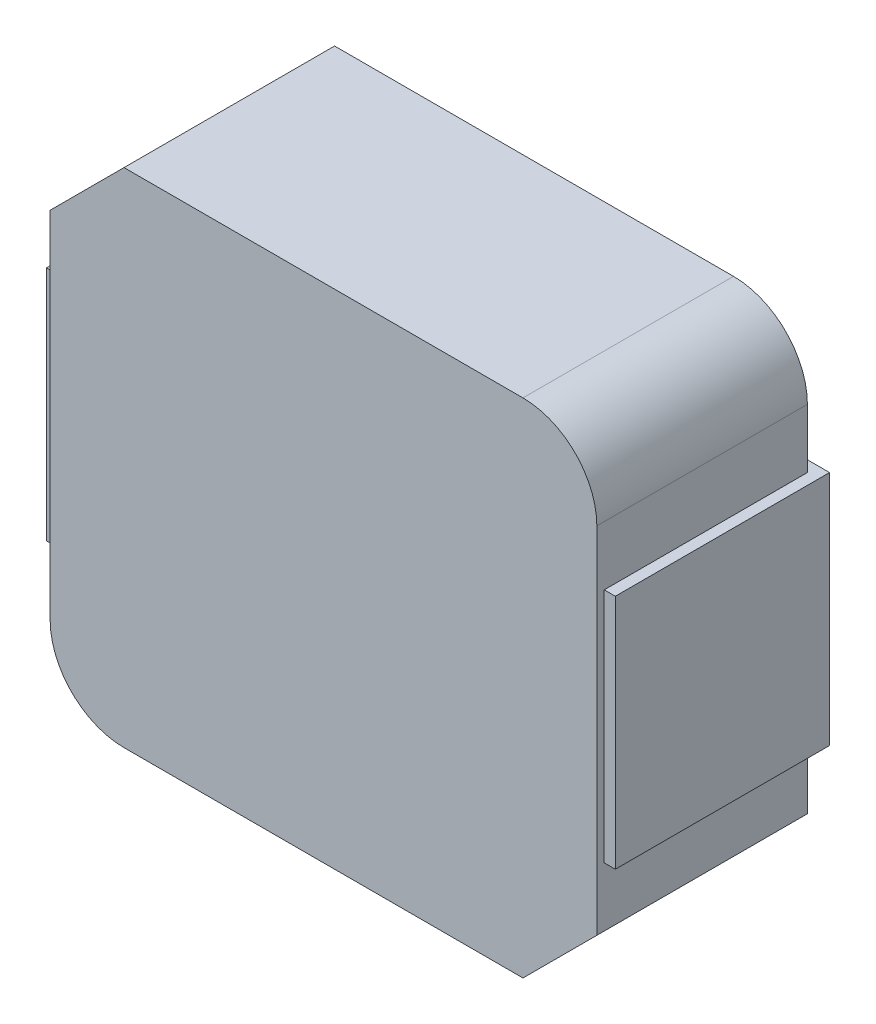
from build123d import *

# Parameters (mm, degrees)
BOSS_EXTRUDE1_START = 0.15
SKETCH1_W           = 7.4
SKETCH1_H           = 6.8
BOSS_EXTRUDE1_DEPTH = 2.85
FILLET1_R           = 1
CHAMFER1_SIZE       = 1
BOSS_EXTRUDE2_DEPTH = 1.6


with BuildPart() as part:
    # Sketch1 → Boss-Extrude1 (new body)
    with BuildSketch(Plane.XY.offset(BOSS_EXTRUDE1_START)):
        Rectangle(SKETCH1_W, SKETCH1_H)
    extrude(amount=BOSS_EXTRUDE1_DEPTH)

    # Fillet1
    fillet1_edges = [part.edges().sort_by_distance(p)[0] for p in [
        (-3.7, -3.4, 1.575),
        (3.7, 3.4, 1.575),
    ]]
    fillet(fillet1_edges, radius=FILLET1_R)

    # Chamfer1
    chamfer1_edges = [part.edges().sort_by_distance(p)[0] for p in [
        (3.7, -3.4, 1.575),
        (-3.7, 3.4, 1.575),
    ]]
    chamfer(chamfer1_edges, length=CHAMFER1_SIZE)

    # Sketch2 → Boss-Extrude2 (add, symmetric)
    with BuildSketch(Plane(origin=(0, 0, 0), x_dir=(1, 0, 0), z_dir=(0, 1, 0))):
        Polygon((2, -0.15), (3.7, -0.15), (3.7, -2.9), (3.85, -2.9), (3.85, 0), (2, 0), align=None)
    boss_extrude2 = extrude(amount=BOSS_EXTRUDE2_DEPTH, both=True)

    # Mirror1: Boss-Extrude2 across plane
    add(boss_extrude2.mirror(Plane(origin=(0, 0, 0), x_dir=(0, 0, 1), z_dir=(1, 0, 0))))


solid = part.part
